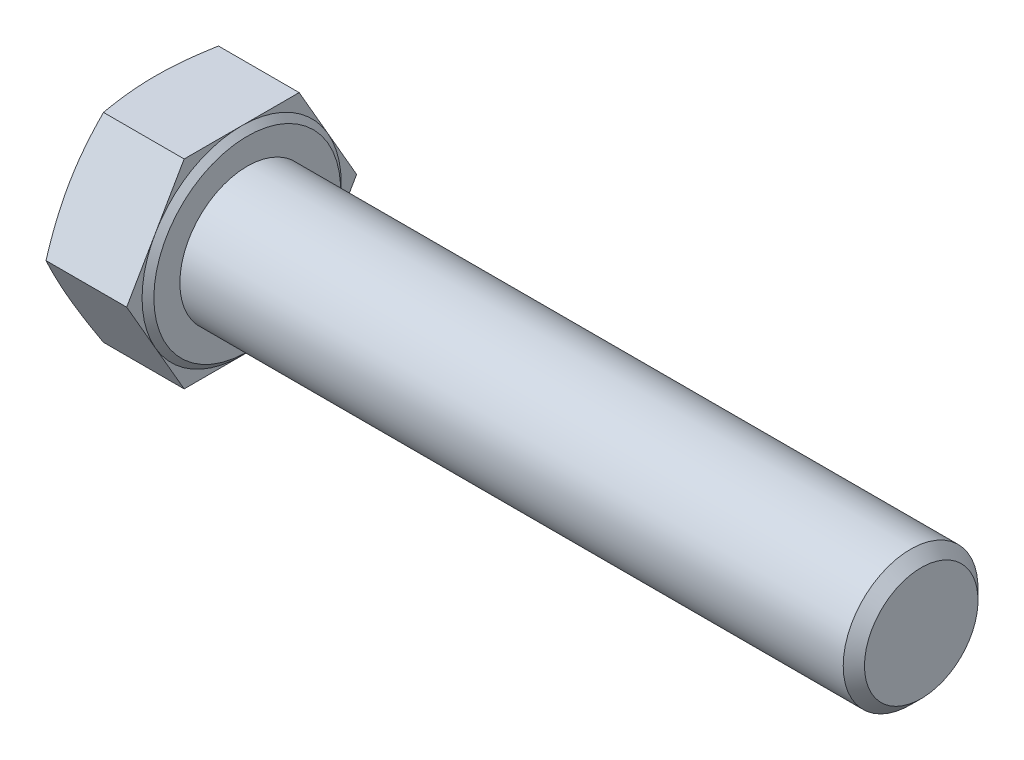
from build123d import *

# Parameters (mm, degrees)
BASEHEAD_DEPTH = 7.68
SKETCH3_R      = 6
BASEBODY_DEPTH = 60
CHAMFER1_SIZE  = 0.947


with BuildPart() as part:
    # Sketch-BaseHead → BaseHead (new body)
    with BuildSketch(Plane(origin=(0, 0, 0), x_dir=(0, 0, -1), z_dir=(1, 0, 0))):
        Polygon((10.236420273, 0), (5.118210136, 8.865), (-5.118210136, 8.865), (-10.236420273, 0), (-5.118210136, -8.865), (5.118210136, -8.865), align=None)
    extrude(amount=BASEHEAD_DEPTH)

    # Sketch4 → HeadChamfer (revolve, cut)
    with BuildSketch(Plane(origin=(-0.264637255, 0, 5.916896391), x_dir=(0, 0, -1), z_dir=(0, 1, 0))):
        Polygon((16.153316664, -0.264637255), (14.781896391, -0.264637255), (16.153316664, -0.763793413), align=None)
    revolve(axis=Axis((-4.001564945, 0, 0), (1, 0, 0)), mode=Mode.SUBTRACT)

    # Sketch1 → Revolve1 (revolve)
    with BuildSketch(Plane.XY, mode=Mode.PRIVATE) as revolve1_sk:
        Polygon((7.68, 0), (8.18, 0), (8.18, -8.315), (7.68, -8.865), align=None)
    revolve(revolve1_sk.sketch.rotate(Axis((-4.001564945, 0, 0), (1, 0, 0)), 270), axis=Axis((-4.001564945, 0, 0), (1, 0, 0)))

    # Sketch3 → BaseBody (add)
    with BuildSketch(Plane(origin=(8.18, 0, 0), x_dir=(0, 0, -1), z_dir=(1, 0, 0))):
        Circle(SKETCH3_R)
    extrude(amount=BASEBODY_DEPTH)

    # Chamfer1
    chamfer1_edges = [part.edges().sort_by_distance(p)[0] for p in [
        (68.18, 0, 6),
    ]]
    chamfer(chamfer1_edges, length=CHAMFER1_SIZE)


solid = part.part
